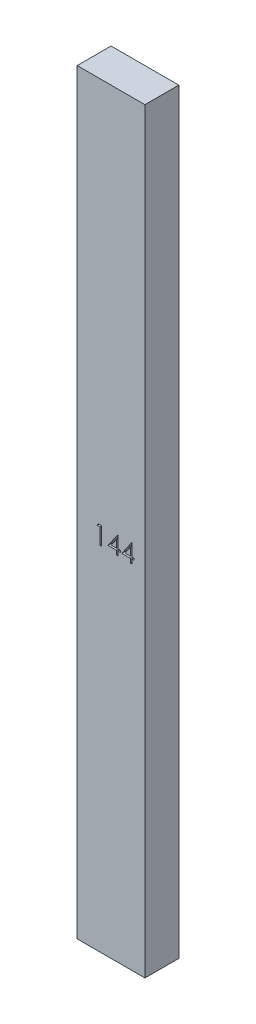
from build123d import *

# Parameters (mm, degrees)
SKETCH1_W           = 12
SKETCH1_H           = 6
BOSS_EXTRUDE1_DEPTH = 134
CUT_EXTRUDE1_DEPTH  = 1


with BuildPart() as part:
    # Sketch1 → Boss-Extrude1 (new body)
    with BuildSketch(Plane(origin=(0, 0, 0), x_dir=(1, 0, 0), z_dir=(0, 1, 0))):
        Rectangle(SKETCH1_W, SKETCH1_H)
    extrude(amount=BOSS_EXTRUDE1_DEPTH)

    # Sketch2 → Cut-Extrude1 (cut)
    # profile 1 of 3: a face of its own
    with BuildSketch(Plane.XY.offset(3)):
        Polygon((-2.293016974, 65.553906762), (-1.705972703, 65.553906762), (-1.705972703, 62.378906762), (-1.990908601, 62.378906762), (-1.990908601, 65.228265736), (-2.479370139, 65.228265736), align=None)
    # profile 2 of 3: a face of its own
    with BuildSketch(Plane.XY.offset(3)):
        Polygon((1.207624052, 65.635317018), (1.265501656, 65.635317018), (1.265501656, 63.437240095), (1.63184781, 63.437240095), (1.63184781, 63.111599069), (1.265501656, 63.111599069), (1.265501656, 62.378906762), (0.980565758, 62.378906762), (0.980565758, 63.111599069), (-0.525523985, 63.111599069), align=None)
        Polygon((0.980565758, 63.437240095), (0.980565758, 64.816126313), (0.034171528, 63.437240095), align=None, mode=Mode.SUBTRACT)
    # profile 3 of 3: a face of its own
    with BuildSketch(Plane.XY.offset(3)):
        Polygon((3.649931744, 65.635317018), (3.707809348, 65.635317018), (3.707809348, 63.437240095), (4.074155502, 63.437240095), (4.074155502, 63.111599069), (3.707809348, 63.111599069), (3.707809348, 62.378906762), (3.422873451, 62.378906762), (3.422873451, 63.111599069), (1.916783707, 63.111599069), align=None)
        Polygon((3.422873451, 63.437240095), (3.422873451, 64.816126313), (2.47647922, 63.437240095), align=None, mode=Mode.SUBTRACT)
    extrude(amount=-CUT_EXTRUDE1_DEPTH, mode=Mode.SUBTRACT)


solid = part.part
